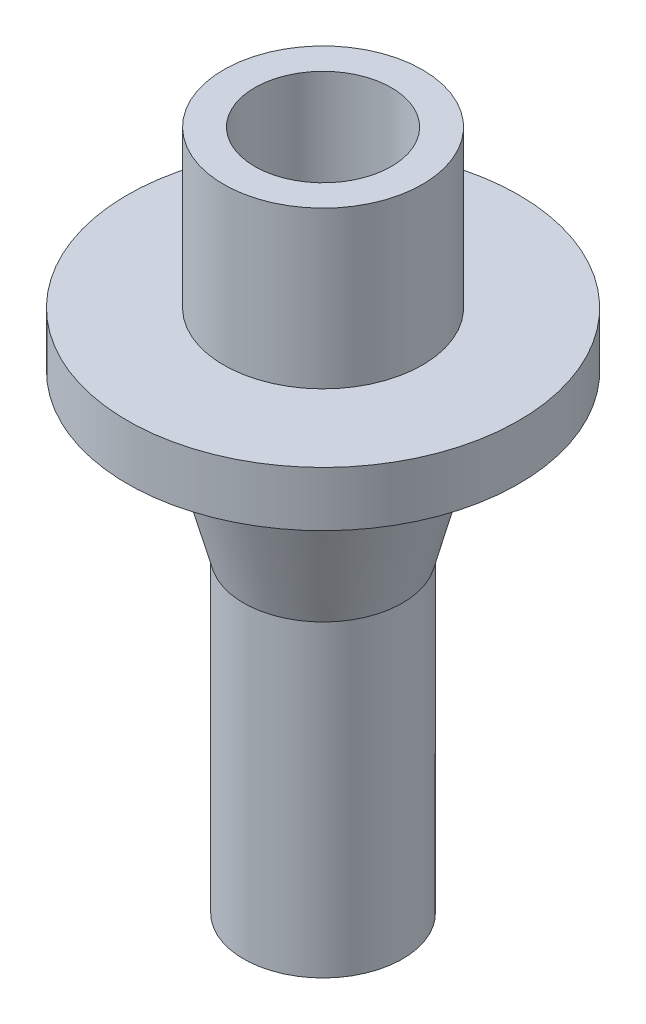
from build123d import *

# Parameters (mm, degrees)
F_3_4_16_TAPPED_HOLE1_D     = 17.4625
F_3_4_16_TAPPED_HOLE1_DEPTH = 20
F_3_4_16_TAPPED_HOLE1_TIP   = 5.24626428
CUT_EXTRUDE1_REACH          = 95.91
SKETCH5_R                   = 7.5


with BuildPart() as part:
    # Sketch1 → Revolve1 (revolve)
    with BuildSketch(Plane(origin=(0, 0, 0), x_dir=(0, 0, -1), z_dir=(1, 0, 0))):
        Polygon((0, 27), (12.7, 27), (12.7, 7), (25, 7), (25, 0), (15.68, 0), (10.16, -20.600920458), (10.16, -60), (0, -60), align=None)
    revolve(axis=Axis((0, 0, 0), (0, 1, 0)))

    # 3/4-16 Tapped Hole1
    with Locations(Plane(origin=(0, 27, 0), x_dir=(1, 0, 0), z_dir=(0, 1, 0))):
        with Locations((0, 0)):
            Hole(F_3_4_16_TAPPED_HOLE1_D / 2, depth=F_3_4_16_TAPPED_HOLE1_DEPTH)
            with Locations((0, 0, -(F_3_4_16_TAPPED_HOLE1_DEPTH + F_3_4_16_TAPPED_HOLE1_TIP / 2))):  # 118° drill point
                Cone(0, F_3_4_16_TAPPED_HOLE1_D / 2, F_3_4_16_TAPPED_HOLE1_TIP, mode=Mode.SUBTRACT)

    # Cut-Extrude1: up to this cone (the profile starts outside it)
    cut_extrude1_end = Plane(origin=(0, -60, 0), z_dir=(0, 1, 0)).offset(61.75373672) * Cone(1.664e-06, 57.677709576, 34.65626328, align=(Align.CENTER, Align.CENTER, Align.MIN), mode=Mode.PRIVATE)
    # Sketch5 → Cut-Extrude1 (cut, up to the surface)
    with BuildSketch(Plane.XZ.offset(60), mode=Mode.PRIVATE) as cut_extrude1_sk1:
        with Locations(Location((0, 0, 0), (0, 0, 270))):
            Circle(SKETCH5_R)
    cut_extrude1_tool1 = extrude(cut_extrude1_sk1.sketch, amount=-CUT_EXTRUDE1_REACH, mode=Mode.PRIVATE) - cut_extrude1_end
    add(cut_extrude1_tool1.solids().sort_by_distance((0, -60, 0))[0], mode=Mode.SUBTRACT)


solid = part.part
